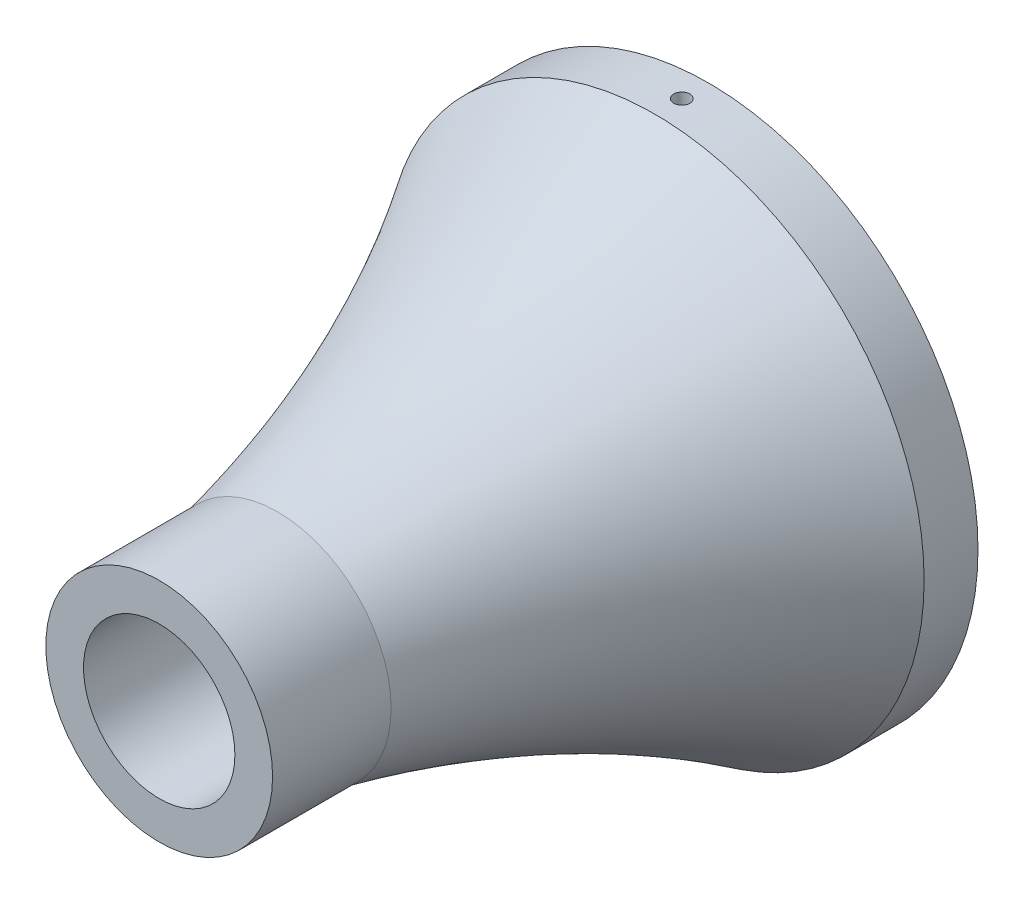
from build123d import *

# Parameters (mm, degrees)
SKETCH2_R               = 50
SKETCH2_R_2             = 25
BOSS_EXTRUDE1_DEPTH     = 10
CUT_EXTRUDE1_DEPTH      = 72.414284285
CUT_EXTRUDE1_DEPTH_BACK = 72.414284285
SKETCH3_R               = 1.5
SKETCH5_W               = 42.1
SKETCH5_H               = 42.1
SKETCH5_W_2             = 28.1
SKETCH5_H_2             = 28.1
BOSS_EXTRUDE3_DEPTH     = 32
SKETCH6_W               = 15
SKETCH6_H               = 10
CUT_EXTRUDE2_DEPTH      = 7
SKETCH7_W               = 42.1
SKETCH7_H               = 42.1
SKETCH7_R               = 14.05
BOSS_EXTRUDE4_DEPTH     = 40
CUT_EXTRUDE3_START      = -72
CUT_EXTRUDE3_DEPTH      = 72
CIRPATTERN1_COUNT       = 4
SKETCH12_R              = 21.05
SKETCH12_W              = 20.1
SKETCH12_H              = 20.1
BOSS_EXTRUDE5_DEPTH     = 10


with BuildPart() as part:
    # Sketch2 → Boss-Extrude1 (new body)
    with BuildSketch(Plane.XY):
        Circle(SKETCH2_R)
        Circle(SKETCH2_R_2, mode=Mode.SUBTRACT)
    extrude(amount=BOSS_EXTRUDE1_DEPTH)

    # Sketch3 → Cut-Extrude1 (cut, two sides: drawn at the far end of the back side and taken through both)
    with BuildSketch(Plane(origin=(0, 0, 0), x_dir=(1, 0, 0), z_dir=(0, 1, 0)).offset(-CUT_EXTRUDE1_DEPTH_BACK)):
        with Locations(Location((0, -5, 0), (0, 0, 270))):
            Circle(SKETCH3_R)
    extrude(amount=CUT_EXTRUDE1_DEPTH + CUT_EXTRUDE1_DEPTH_BACK, mode=Mode.SUBTRACT)



with BuildPart() as body_2:
    # Sketch5 → Boss-Extrude3 (new body)
    with BuildSketch(Plane.XY.offset(30)):
        Rectangle(SKETCH5_W, SKETCH5_H)
        Rectangle(SKETCH5_W_2, SKETCH5_H_2, mode=Mode.SUBTRACT)
    extrude(amount=BOSS_EXTRUDE3_DEPTH)

    # Sketch6 → Cut-Extrude2 (cut)
    with BuildSketch(Plane(origin=(0, 21.05, 0), x_dir=(1, 0, 0), z_dir=(0, 1, 0))):
        with Locations((0, -37.5)):
            Rectangle(SKETCH6_W, SKETCH6_H)
    extrude(amount=-CUT_EXTRUDE2_DEPTH, mode=Mode.SUBTRACT)

    # Sketch7 → Boss-Extrude4 (add)
    with BuildSketch(Plane.XY.offset(62)):
        Rectangle(SKETCH7_W, SKETCH7_H)
        Circle(SKETCH7_R, mode=Mode.SUBTRACT)
    extrude(amount=BOSS_EXTRUDE4_DEPTH)

    # Sketch11 → Cut-Extrude3 (cut)
    with BuildSketch(Plane.XY.offset(102).offset(CUT_EXTRUDE3_START)):
        with BuildLine():
            Line((0, 21.05), (-21.05, 21.05))
            Line((-21.05, 21.05), (-21.05, 0))
            ThreePointArc((-21.05, 0), (-14.884597744, 14.884597744), (0, 21.05))
        make_face()
    cut_extrude3 = extrude(amount=CUT_EXTRUDE3_DEPTH, mode=Mode.SUBTRACT)

    # CirPattern1: Cut-Extrude3 ×4 about axis
    cirpattern1_axis = Axis((0, 0, 102), (0, 0, 1))
    for i in range(1, CIRPATTERN1_COUNT):
        add(cut_extrude3.rotate(cirpattern1_axis, i * 360 / CIRPATTERN1_COUNT), mode=Mode.SUBTRACT)


with BuildPart() as part_1:
    add(part.part)

    add(body_2.part)  # Revolve2 merges body 2
    # Sketch10 → Revolve2 (revolve)
    with BuildSketch(Plane(origin=(0, 0, 0), x_dir=(1, 0, 0), z_dir=(0, 1, 0))):
        with BuildLine():
            Line((-50, -10), (-25, -10))
            add(Edge.make_bspline(
                [(-25, -10), (-21.924679616, -19.790318995), (-21.05, -30)],
                knots=[0, 0, 0, 1, 1, 1], degree=2))
            Line((-21.05, -30), (-21.05, -80))
            add(Edge.make_bspline(
                [(-50, -10), (-29.091325996, -42.246977979), (-21.05, -80)],
                knots=[0, 0, 0, 1, 1, 1], degree=2))
        make_face()
    revolve(axis=Axis((0, 0, 0), (0, 0, 1)))

    # Sketch12 → Boss-Extrude5 (add)
    with BuildSketch(Plane(origin=(0, 0, 30), x_dir=(-1, 0, 0), z_dir=(0, 0, -1))):
        with Locations(Location((0, 0, 0), (0, 0, 180))):
            Circle(SKETCH12_R)
        Rectangle(SKETCH12_W, SKETCH12_H, mode=Mode.SUBTRACT)
    extrude(amount=BOSS_EXTRUDE5_DEPTH)


solid = part_1.part
